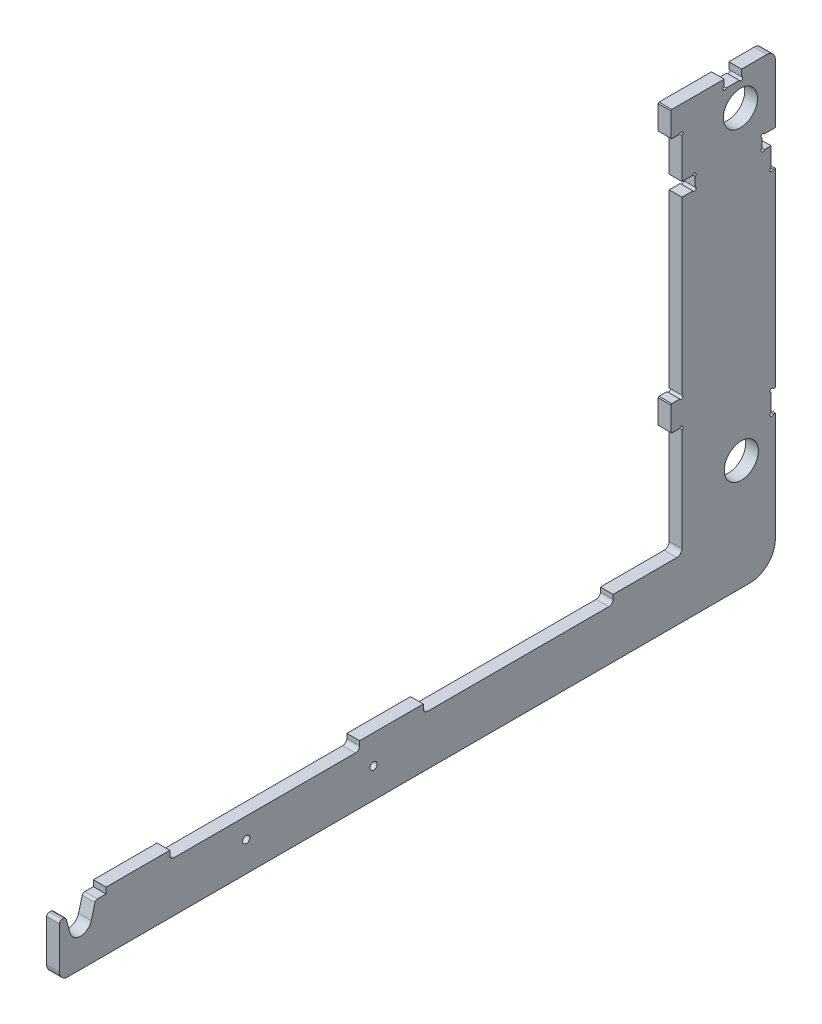
from build123d import *

# Parameters (mm, degrees)
BOSS_EXTRUDE1_DEPTH = 15
FILLET1_R           = 30
SKETCH2_R           = 20.1
CUT_EXTRUDE1_DEPTH  = 820.456527218
FILLET2_R           = 6
SKETCH4_W           = 15
SKETCH4_H           = 30
BOSS_EXTRUDE2_DEPTH = 13
FILLET3_R           = 10
SKETCH5_W           = 20.5
SKETCH5_H           = 10.25
CUT_EXTRUDE3_DEPTH  = 820.456527218
SKETCH6_W           = 15.5
SKETCH6_H           = 16
CUT_EXTRUDE4_DEPTH  = 820.456527218
SKETCH7_W           = 5
SKETCH7_H           = 25.5
SKETCH7_H_2         = 26
CUT_EXTRUDE5_DEPTH  = 820.456527218
CHAMFER1_SIZE       = 1
SKETCH8_W           = 223.5
SKETCH8_H           = 10
CUT_EXTRUDE6_DEPTH  = 15
FILLET4_R           = 5
SKETCH9_R           = 2
CUT_EXTRUDE7_DEPTH  = 820.456527218
SKETCH10_R          = 2
CUT_EXTRUDE8_DEPTH  = 820.456527218
SKETCH11_R          = 2
CUT_EXTRUDE9_DEPTH  = 820.456527218
SKETCH12_R          = 2
CUT_EXTRUDE10_DEPTH = 820.456527218
BOSS_EXTRUDE3_DEPTH = 15
FILLET5_R           = 10
FILLET6_R           = 3
SKETCH14_R          = 4.25
CUT_EXTRUDE11_DEPTH = 866.513720284


with BuildPart() as part:
    # Sketch1 → Boss-Extrude1 (new body)
    with BuildSketch(Plane(origin=(0, 0, 0), x_dir=(0, 0, -1), z_dir=(1, 0, 0))):
        Polygon((-678, 0), (0, 0), (0, 460), (110, 460), (110, -69), (-678, -69), align=None)
    extrude(amount=BOSS_EXTRUDE1_DEPTH)

    # Fillet1
    fillet1_edges = [part.edges().sort_by_distance(p)[0] for p in [
        (7.5, -69, -110),
    ]]
    fillet(fillet1_edges, radius=FILLET1_R)

    # Sketch2 → Cut-Extrude1 (cut, through all)
    with BuildSketch(Plane(origin=(15, 0, 0), x_dir=(0, 0, -1), z_dir=(1, 0, 0))):
        with Locations((68.9, 421)):
            Circle(SKETCH2_R)
        with Locations((69.9, 61)):
            Circle(SKETCH2_R)
    extrude(amount=-CUT_EXTRUDE1_DEPTH, mode=Mode.SUBTRACT)

    # Fillet2
    fillet2_edges = [part.edges().sort_by_distance(p)[0] for p in [
        (7.5, 0, 0),
    ]]
    fillet(fillet2_edges, radius=FILLET2_R)

    # Sketch4 → Boss-Extrude2 (add)
    with BuildSketch(Plane.XY):
        with Locations((7.5, 445)):
            Rectangle(SKETCH4_W, SKETCH4_H)
        with Locations((7.5, 145)):
            Rectangle(SKETCH4_W, SKETCH4_H)
    extrude(amount=BOSS_EXTRUDE2_DEPTH)

    # Fillet3
    fillet3_edges = [part.edges().sort_by_distance(p)[0] for p in [
        (7.5, 460, -110),
    ]]
    fillet(fillet3_edges, radius=FILLET3_R)

    # Sketch5 → Cut-Extrude3 (cut, through all)
    with BuildSketch(Plane.ZY):
        with Locations((-60, 454.875)):
            Rectangle(SKETCH5_W, SKETCH5_H)
    extrude(amount=-CUT_EXTRUDE3_DEPTH, mode=Mode.SUBTRACT)

    # Sketch6 → Cut-Extrude4 (cut, through all)
    with BuildSketch(Plane(origin=(15, 0, 0), x_dir=(0, 0, -1), z_dir=(1, 0, 0))):
        with Locations((102.25, 372.5)):
            Rectangle(SKETCH6_W, SKETCH6_H)
        with Locations((7.75, 372.5)):
            Rectangle(SKETCH6_W, SKETCH6_H)
    extrude(amount=-CUT_EXTRUDE4_DEPTH, mode=Mode.SUBTRACT)

    # Sketch7 → Cut-Extrude5 (cut, through all)
    with BuildSketch(Plane.ZY):
        with Locations((-107.5, 351.75)):
            Rectangle(SKETCH7_W, SKETCH7_H)
        with Locations((-107.5, 102.5)):
            Rectangle(SKETCH7_W, SKETCH7_H_2)
    extrude(amount=-CUT_EXTRUDE5_DEPTH, mode=Mode.SUBTRACT)

    # Chamfer1
    chamfer1_edges = [part.edges().sort_by_distance(p)[0] for p in [
        (7.5, 430, 13),
        (7.5, 460, 13),
        (7.5, 130, 13),
        (7.5, 160, 13),
    ]]
    chamfer(chamfer1_edges, length=CHAMFER1_SIZE)

    # Sketch8 → Cut-Extrude6 (cut)
    with BuildSketch(Plane(origin=(15, 0, 0), x_dir=(0, 0, -1), z_dir=(1, 0, 0))):
        with Locations((-491.25, -5)):
            Rectangle(SKETCH8_W, SKETCH8_H)
        with Locations((-192.75, -5)):
            Rectangle(SKETCH8_W, SKETCH8_H)
    extrude(amount=-CUT_EXTRUDE6_DEPTH, mode=Mode.SUBTRACT)

    # Fillet4
    fillet4_edges = [part.edges().sort_by_distance(p)[0] for p in [
        (7.5, -10, 603),
        (7.5, -10, 379.5),
        (7.5, -10, 81),
        (7.5, -10, 304.5),
    ]]
    fillet(fillet4_edges, radius=FILLET4_R)

    # Sketch9 → Cut-Extrude7 (cut, through all)
    with BuildSketch(Plane(origin=(15, 0, 0), x_dir=(0, 0, -1), z_dir=(1, 0, 0))):
        with Locations((-0.707106781, 129.292893219)):
            Circle(SKETCH9_R)
        with Locations((-0.707106781, 160.707106781)):
            Circle(SKETCH9_R)
        with Locations((-0.707106781, 429.292893219)):
            Circle(SKETCH9_R)
    extrude(amount=-CUT_EXTRUDE7_DEPTH, mode=Mode.SUBTRACT)

    # Sketch10 → Cut-Extrude8 (cut, through all)
    with BuildSketch(Plane(origin=(15, 0, 0), x_dir=(0, 0, -1), z_dir=(1, 0, 0))):
        with Locations((50.457106781, 450.457106781)):
            Circle(SKETCH10_R)
        with Locations((69.542893219, 450.457106781)):
            Circle(SKETCH10_R)
    extrude(amount=-CUT_EXTRUDE8_DEPTH, mode=Mode.SUBTRACT)

    # Sketch11 → Cut-Extrude9 (cut, through all)
    with BuildSketch(Plane(origin=(15, 0, 0), x_dir=(0, 0, -1), z_dir=(1, 0, 0))):
        with Locations((14.792893219, 365.207106781)):
            Circle(SKETCH11_R)
        with Locations((14.792893219, 379.792893219)):
            Circle(SKETCH11_R)
        with Locations((95.207106781, 379.792893219)):
            Circle(SKETCH11_R)
        with Locations((95.207106781, 365.207106781)):
            Circle(SKETCH11_R)
    extrude(amount=-CUT_EXTRUDE9_DEPTH, mode=Mode.SUBTRACT)

    # Sketch12 → Cut-Extrude10 (cut, through all)
    with BuildSketch(Plane(origin=(15, 0, 0), x_dir=(0, 0, -1), z_dir=(1, 0, 0))):
        with Locations((105.707106781, 90.207106781)):
            Circle(SKETCH12_R)
        with Locations((105.707106781, 114.792893219)):
            Circle(SKETCH12_R)
        with Locations((105.707106781, 339.707106781)):
            Circle(SKETCH12_R)
    extrude(amount=-CUT_EXTRUDE10_DEPTH, mode=Mode.SUBTRACT)

    # Sketch13 → Boss-Extrude3 (add)
    with BuildSketch(Plane(origin=(15, 0, 0), x_dir=(0, 0, -1), z_dir=(1, 0, 0))):
        with BuildLine():
            Line((-678, -69), (-733, -69))
            Line((-733, -69), (-733, -7))
            Line((-733, -7), (-725.5, -7))
            Line((-725.5, -7), (-720.55324034, -25.378780397))
            ThreePointArc((-720.55324034, -25.378780397), (-708, -35), (-695.44675966, -25.378780397))
            Line((-695.44675966, -25.378780397), (-690.5, -7))
            Line((-690.5, -7), (-678, -7))
            Line((-678, -7), (-678, -69))
        make_face()
    extrude(amount=-BOSS_EXTRUDE3_DEPTH)

    # Fillet5
    fillet5_edges = [part.edges().sort_by_distance(p)[0] for p in [
        (7.5, -69, 733),
    ]]
    fillet(fillet5_edges, radius=FILLET5_R)

    # Fillet6
    fillet6_edges = [part.edges().sort_by_distance(p)[0] for p in [
        (7.5, -7, 733),
        (7.5, -7, 725.5),
        (7.5, -7, 690.5),
    ]]
    fillet(fillet6_edges, radius=FILLET6_R)

    # Sketch14 → Cut-Extrude11 (cut, through all)
    with BuildSketch(Plane(origin=(15, 0, 0), x_dir=(0, 0, -1), z_dir=(1, 0, 0))):
        with Locations((-513, -34)):
            Circle(SKETCH14_R)
        with Locations((-363, -34)):
            Circle(SKETCH14_R)
    extrude(amount=-CUT_EXTRUDE11_DEPTH, mode=Mode.SUBTRACT)


solid = part.part
